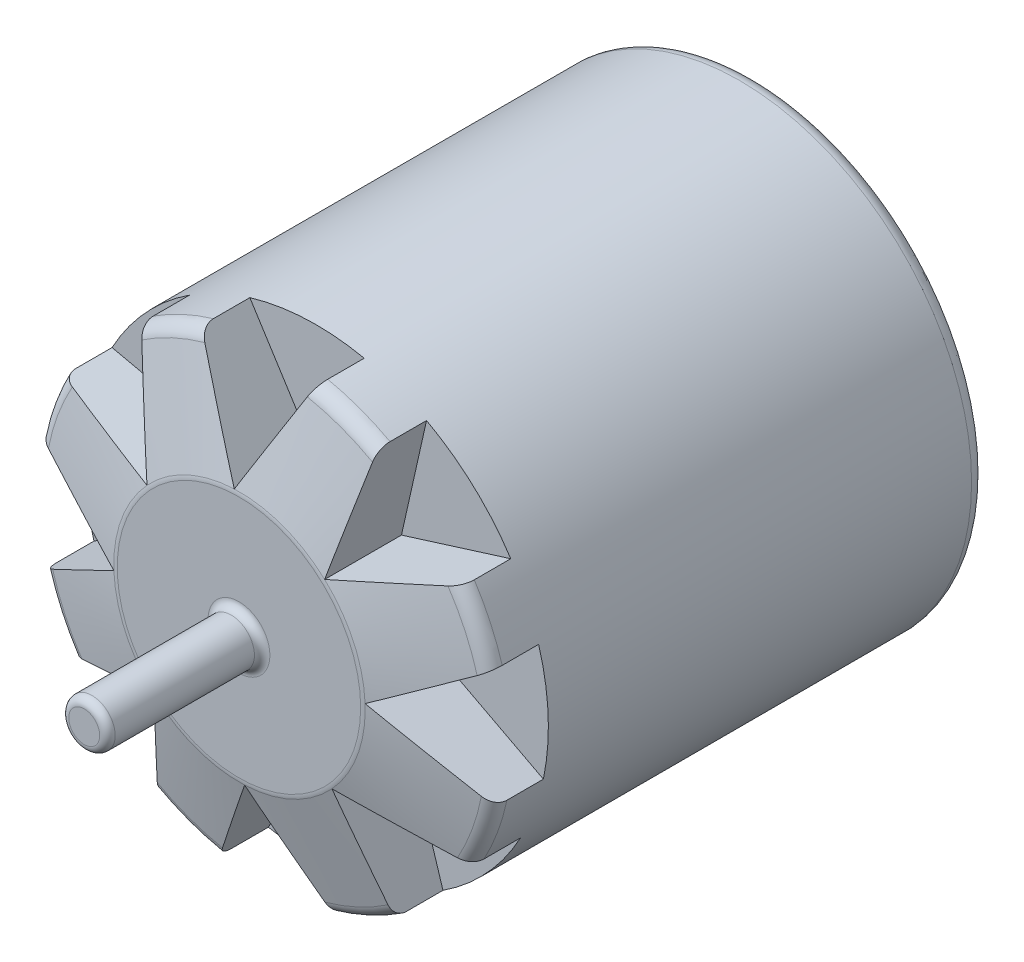
from build123d import *

# Parameters (mm, degrees)
SKETCH1_R           = 15
BOSS_EXTRUDE1_DEPTH = 35
CHAMFER1_SIZE       = 7
CHAMFER1_SIZE2      = 1.875644347
FILLET1_R           = 1
SKETCH2_R           = 1.5
BOSS_EXTRUDE2_DEPTH = 10
CHAMFER2_SIZE       = 7
CHAMFER2_SIZE2      = 1.875644347
FILLET2_R           = 1
CUT_EXTRUDE2_START  = -5
CUT_EXTRUDE2_DEPTH  = 5
FILLET4_R           = 0.5
FILLET5_R           = 0.5


with BuildPart() as part:
    # Sketch1 → Boss-Extrude1 (new body)
    with BuildSketch(Plane.XY):
        Circle(SKETCH1_R)
    extrude(amount=BOSS_EXTRUDE1_DEPTH)

    # Chamfer1
    chamfer1_edges = [part.edges().sort_by_distance(p)[0] for p in [
        (-15, 0, 0),
    ]]
    chamfer1_side = [part.faces().sort_by_distance(p)[0] for p in [
        (0, 0, 0),
    ]]
    chamfer(chamfer1_edges, length=CHAMFER1_SIZE, length2=CHAMFER1_SIZE2, reference=chamfer1_side[0])

    # Fillet1
    fillet1_edges = [part.edges().sort_by_distance(p)[0] for p in [
        (-15, 0, 1.875644347),
        (-8, 0, 0),
    ]]
    fillet(fillet1_edges, radius=FILLET1_R)

    # Sketch2 → Boss-Extrude2 (add)
    with BuildSketch(Plane.XY.offset(35)):
        Circle(SKETCH2_R)
    extrude(amount=BOSS_EXTRUDE2_DEPTH)

    # Chamfer2
    chamfer2_edges = [part.edges().sort_by_distance(p)[0] for p in [
        (-15, 0, 35),
    ]]
    chamfer2_side = [part.faces().sort_by_distance(p)[0] for p in [
        (-14.575735931, 0, 35),
    ]]
    chamfer(chamfer2_edges, length=CHAMFER2_SIZE, length2=CHAMFER2_SIZE2, reference=chamfer2_side[0])

    # Fillet2
    fillet2_edges = [part.edges().sort_by_distance(p)[0] for p in [
        (-8, 0, 35),
        (-15, 0, 33.124355653),
    ]]
    fillet(fillet2_edges, radius=FILLET2_R)

    # Sketch3 → Cut-Extrude2 (cut)
    with BuildSketch(Plane.XY.offset(35).offset(CUT_EXTRUDE2_START)):
        with BuildLine():
            Line((-0.334778184, 8.120268447), (-4.296028206, 14.371643666))
            ThreePointArc((-4.296028206, 14.371643666), (-0.617887271, 14.987268441), (3.098446552, 14.676499207))
            Line((3.098446552, 14.676499207), (-0.334778184, 8.120268447))
        make_face()
        with BuildLine():
            Line((12.568784681, 8.186919545), (5.50517296, 5.978620808))
            Line((5.50517296, 5.978620808), (7.124536016, 13.20003737))
            ThreePointArc((7.124536016, 13.20003737), (10.160686867, 11.034511425), (12.568784681, 8.186919545))
        make_face()
        with BuildLine():
            Line((14.676499207, -3.098446552), (8.120268447, 0.334778184))
            Line((8.120268447, 0.334778184), (14.371643666, 4.296028206))
            ThreePointArc((14.371643666, 4.296028206), (14.987268441, 0.617887271), (14.676499207, -3.098446552))
        make_face()
        with BuildLine():
            Line((8.186919545, -12.568784681), (5.978620808, -5.50517296))
            Line((5.978620808, -5.50517296), (13.20003737, -7.124536016))
            ThreePointArc((13.20003737, -7.124536016), (11.034511425, -10.160686867), (8.186919545, -12.568784681))
        make_face()
        with BuildLine():
            Line((-3.098446552, -14.676499207), (0.334778184, -8.120268447))
            Line((0.334778184, -8.120268447), (4.296028206, -14.371643666))
            ThreePointArc((4.296028206, -14.371643666), (0.617887271, -14.987268441), (-3.098446552, -14.676499207))
        make_face()
        with BuildLine():
            Line((-12.568784681, -8.186919545), (-5.50517296, -5.978620808))
            Line((-5.50517296, -5.978620808), (-7.124536016, -13.20003737))
            ThreePointArc((-7.124536016, -13.20003737), (-10.160686867, -11.034511425), (-12.568784681, -8.186919545))
        make_face()
        with BuildLine():
            Line((-14.676499207, 3.098446552), (-8.120268447, -0.334778184))
            Line((-8.120268447, -0.334778184), (-14.371643666, -4.296028206))
            ThreePointArc((-14.371643666, -4.296028206), (-14.987268441, -0.617887271), (-14.676499207, 3.098446552))
        make_face()
        with BuildLine():
            Line((-8.186919545, 12.568784681), (-5.978620808, 5.50517296))
            Line((-5.978620808, 5.50517296), (-13.20003737, 7.124536016))
            ThreePointArc((-13.20003737, 7.124536016), (-11.034511425, 10.160686867), (-8.186919545, 12.568784681))
        make_face()
    extrude(amount=CUT_EXTRUDE2_DEPTH, mode=Mode.SUBTRACT)


with BuildPart() as cut_extrude2_kept_piece:
    # of the separate pieces the step leaves, the one the design keeps (cut_extrude2_pieces_kept)
    add(part.part.solids().sort_by_distance((15, 0, 2.642971335))[0])

    # Fillet4
    fillet4_edges = [cut_extrude2_kept_piece.edges().sort_by_distance(p)[0] for p in [
        (-1.5, 0, 45),
    ]]
    fillet(fillet4_edges, radius=FILLET4_R)

    # Fillet5
    fillet5_edges = [cut_extrude2_kept_piece.edges().sort_by_distance(p)[0] for p in [
        (-1.5, 0, 35),
    ]]
    fillet(fillet5_edges, radius=FILLET5_R)


solid = cut_extrude2_kept_piece.part
